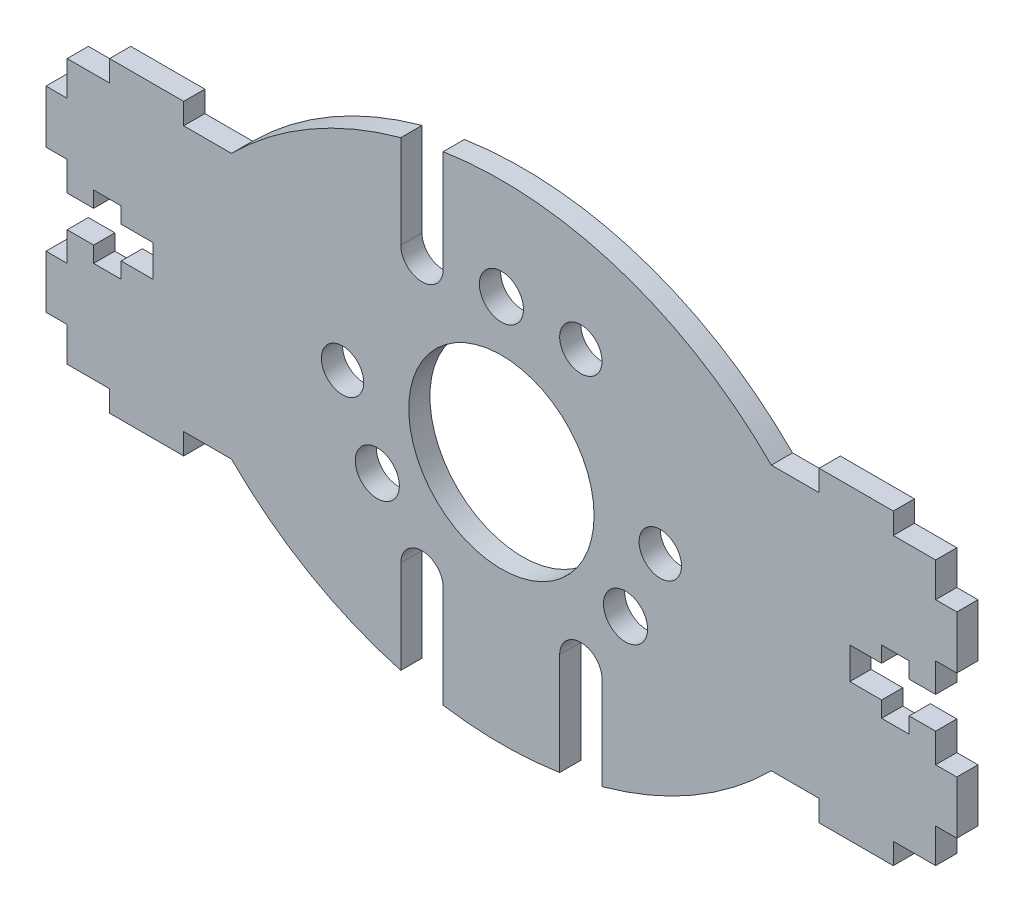
from build123d import *

# Parameters (mm, degrees)
SKETCH_1_R      = 2
SKETCH_1_R_2    = 2.08
SKETCH_1_R_3    = 8.75
EXTRUDE_2_DEPTH = 2


with BuildPart() as part:
    # 草图1 → 凸台-拉伸2 (new body)
    with BuildSketch(Plane.XY):
        with BuildLine():
            Line((-41, 4.25), (-43, 4.25))
            Line((-43, 4.25), (-43, 9.25))
            Line((-43, 9.25), (-41, 9.25))
            Line((-41, 9.25), (-41, 12.5))
            Line((-41, 12.5), (-37, 12.5))
            Line((-37, 12.5), (-37, 14.5))
            Line((-37, 14.5), (-30, 14.5))
            Line((-30, 14.5), (-30, 12.5))
            Line((-30, 12.5), (-25.488968202, 12.5))
            ThreePointArc((-25.488968202, 12.5), (-18.099802413, 18.184292016), (-9.5, 21.783506545))
            Line((-9.5, 21.783506545), (-9.5, 12.990381057))
            ThreePointArc((-9.5, 12.990381057), (-7.5, 10.990381057), (-5.5, 12.990381057))
            Line((-5.5, 12.990381057), (-5.5, 22.635812499))
            ThreePointArc((-5.5, 22.635812499), (11.205953159, 21.271820081), (25.488968202, 12.5))
            Line((25.488968202, 12.5), (30, 12.5))
            Line((30, 12.5), (30, 14.5))
            Line((30, 14.5), (37, 14.5))
            Line((37, 14.5), (37, 12.5))
            Line((37, 12.5), (41, 12.5))
            Line((41, 12.5), (41, 9.25))
            Line((41, 9.25), (43, 9.25))
            Line((43, 9.25), (43, 4.25))
            Line((43, 4.25), (41, 4.25))
            Line((41, 4.25), (41, 1.5))
            Line((41, 1.5), (38.5, 1.5))
            Line((38.5, 1.5), (38.5, 3))
            Line((38.5, 3), (35.9, 3))
            Line((35.9, 3), (35.9, 1.5))
            Line((35.9, 1.5), (32.9, 1.5))
            Line((32.9, 1.5), (32.9, -1.5))
            Line((32.9, -1.5), (35.9, -1.5))
            Line((35.9, -1.5), (35.9, -3))
            Line((35.9, -3), (38.5, -3))
            Line((38.5, -3), (38.5, -1.5))
            Line((38.5, -1.5), (41, -1.5))
            Line((41, -1.5), (41, -4.25))
            Line((41, -4.25), (43, -4.25))
            Line((43, -4.25), (43, -9.25))
            Line((43, -9.25), (41, -9.25))
            Line((41, -9.25), (41, -12.5))
            Line((41, -12.5), (37, -12.5))
            Line((37, -12.5), (37, -14.5))
            Line((37, -14.5), (30, -14.5))
            Line((30, -14.5), (30, -12.5))
            Line((30, -12.5), (25.488968202, -12.5))
            ThreePointArc((25.488968202, -12.5), (18.099802413, -18.184292016), (9.5, -21.783506545))
            Line((9.5, -21.783506545), (9.5, -12.990381057))
            ThreePointArc((9.5, -12.990381057), (7.5, -10.990381057), (5.5, -12.990381057))
            Line((5.5, -12.990381057), (5.5, -22.635812499))
            ThreePointArc((5.5, -22.635812499), (0, -23.05787632), (-5.5, -22.635812499))
            Line((-5.5, -22.635812499), (-5.5, -12.990381057))
            ThreePointArc((-5.5, -12.990381057), (-7.5, -10.990381057), (-9.5, -12.990381057))
            Line((-9.5, -12.990381057), (-9.5, -21.783506545))
            ThreePointArc((-9.5, -21.783506545), (-18.099802413, -18.184292016), (-25.488968202, -12.5))
            Line((-25.488968202, -12.5), (-30, -12.5))
            Line((-30, -12.5), (-30, -14.5))
            Line((-30, -14.5), (-37, -14.5))
            Line((-37, -14.5), (-37, -12.5))
            Line((-37, -12.5), (-41, -12.5))
            Line((-41, -12.5), (-41, -9.25))
            Line((-41, -9.25), (-43, -9.25))
            Line((-43, -9.25), (-43, -4.25))
            Line((-43, -4.25), (-41, -4.25))
            Line((-41, -4.25), (-41, -1.5))
            Line((-41, -1.5), (-38.5, -1.5))
            Line((-38.5, -1.5), (-38.5, -3))
            Line((-38.5, -3), (-35.9, -3))
            Line((-35.9, -3), (-35.9, -1.5))
            Line((-35.9, -1.5), (-32.9, -1.5))
            Line((-32.9, -1.5), (-32.9, 1.5))
            Line((-32.9, 1.5), (-35.9, 1.5))
            Line((-35.9, 1.5), (-35.9, 3))
            Line((-35.9, 3), (-38.5, 3))
            Line((-38.5, 3), (-38.5, 1.5))
            Line((-38.5, 1.5), (-41, 1.5))
            Line((-41, 1.5), (-41, 4.25))
        make_face()
        with Locations((-15, 0)):
            Circle(SKETCH_1_R, mode=Mode.SUBTRACT)
        with Locations((7.5, 12.990381057)):
            Circle(SKETCH_1_R, mode=Mode.SUBTRACT)
        with Locations((15, 0)):
            Circle(SKETCH_1_R, mode=Mode.SUBTRACT)
        with Locations((0, 13.53)):
            Circle(SKETCH_1_R_2, mode=Mode.SUBTRACT)
        with Locations((11.717323713, -6.765)):
            Circle(SKETCH_1_R_2, mode=Mode.SUBTRACT)
        with Locations((-11.717323713, -6.765)):
            Circle(SKETCH_1_R_2, mode=Mode.SUBTRACT)
        Circle(SKETCH_1_R_3, mode=Mode.SUBTRACT)
    extrude(amount=EXTRUDE_2_DEPTH)


solid = part.part
